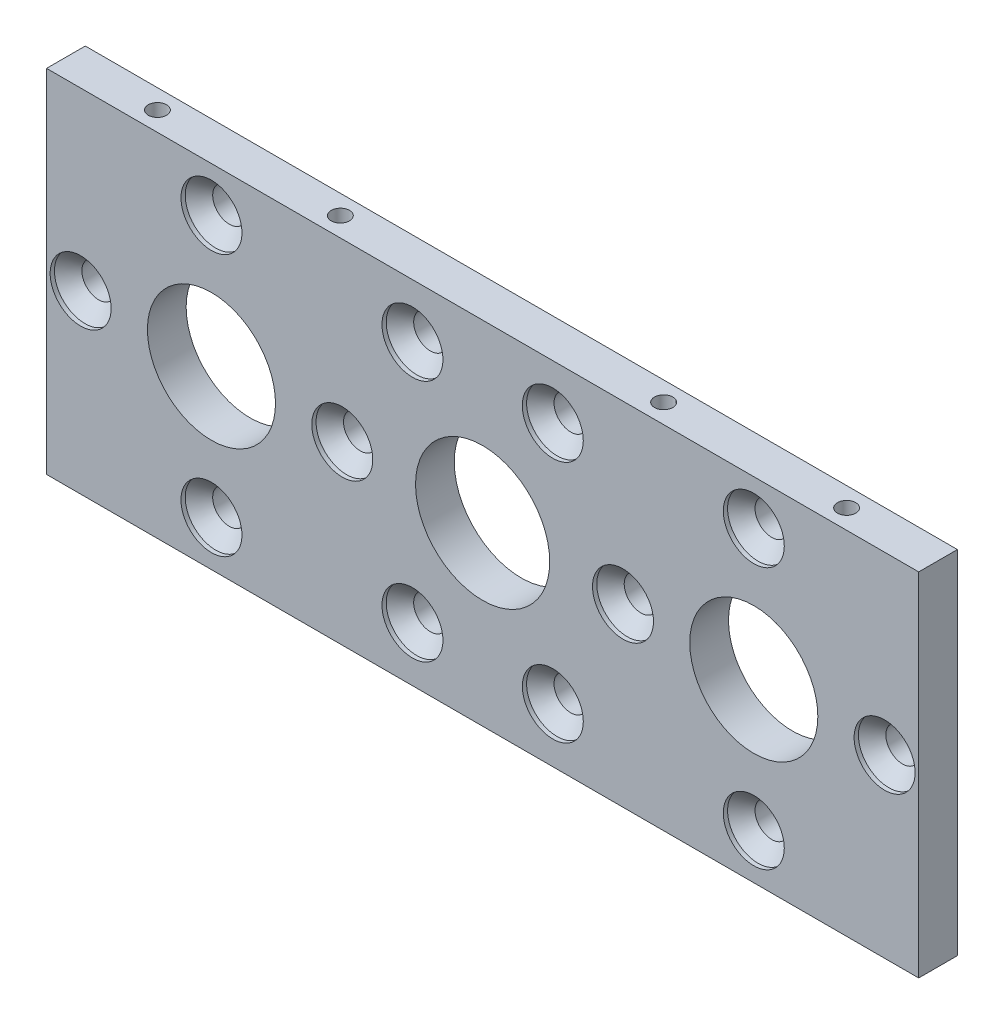
from build123d import *

# Parameters (mm, degrees)
ESBO_O1_W                        = 143.01
ESBO_O1_H                        = 54.05
RESSALTO_EXTRUS_O1_DEPTH         = 6.35
ESBO_O2_R                        = 2.75
CORTE_EXTRUS_O1_DEPTH            = 10
ESBO_O3_R                        = 10.5
ESBO_O3_R_2                      = 11
CORTE_EXTRUS_O2_DEPTH            = 10
ESBO_O4_W                        = 143.01
ESBO_O4_H                        = 3.62
RESSALTO_EXTRUS_O2_DEPTH         = 6.35
ESBO_O8_R                        = 1.5
CORTE_EXTRUS_O3_DEPTH            = 15
ESBO_O9_R                        = 5
CORTE_EXTRUS_O4_DEPTH            = 0.7
ESBO_O12_R                       = 5
CORTE_EXTRUS_O5_DEPTH            = 2.5
CORTE_EXTRUS_O5_DRAFT            = -45
CORTE_EXTRUS_O5_PROFILE_2_DEPTH  = 2.5
CORTE_EXTRUS_O5_PROFILE_2_DRAFT  = -45
CORTE_EXTRUS_O5_PROFILE_3_DEPTH  = 2.5
CORTE_EXTRUS_O5_PROFILE_3_DRAFT  = -45
CORTE_EXTRUS_O5_PROFILE_4_DEPTH  = 2.5
CORTE_EXTRUS_O5_PROFILE_4_DRAFT  = -45
CORTE_EXTRUS_O5_PROFILE_5_DEPTH  = 2.5
CORTE_EXTRUS_O5_PROFILE_5_DRAFT  = -45
CORTE_EXTRUS_O5_PROFILE_6_DEPTH  = 2.5
CORTE_EXTRUS_O5_PROFILE_6_DRAFT  = -45
CORTE_EXTRUS_O5_PROFILE_7_DEPTH  = 2.5
CORTE_EXTRUS_O5_PROFILE_7_DRAFT  = -45
CORTE_EXTRUS_O5_PROFILE_8_DEPTH  = 2.5
CORTE_EXTRUS_O5_PROFILE_8_DRAFT  = -45
CORTE_EXTRUS_O5_PROFILE_9_DEPTH  = 2.5
CORTE_EXTRUS_O5_PROFILE_9_DRAFT  = -45
CORTE_EXTRUS_O5_PROFILE_10_DEPTH = 2.5
CORTE_EXTRUS_O5_PROFILE_10_DRAFT = -45
CORTE_EXTRUS_O5_PROFILE_11_DEPTH = 2.5
CORTE_EXTRUS_O5_PROFILE_11_DRAFT = -45
CORTE_EXTRUS_O5_PROFILE_12_DEPTH = 2.5
CORTE_EXTRUS_O5_PROFILE_12_DRAFT = -45


with BuildPart() as part:
    # Esboço1 → Ressalto-extrusão1 (new body)
    with BuildSketch(Plane.XY):
        Rectangle(ESBO_O1_W, ESBO_O1_H)
    extrude(amount=RESSALTO_EXTRUS_O1_DEPTH)

    # Esboço2 → Corte-extrusão1 (cut)
    with BuildSketch(Plane(origin=(0, 0, 0), x_dir=(-1, 0, 0), z_dir=(0, 0, -1))):
        with Locations((-44.463136928, 23.291850449)):
            Circle(ESBO_O2_R)
        with Locations((-65.913136928, 1.841850449)):
            Circle(ESBO_O2_R)
        with Locations((-44.463136928, -19.608149551)):
            Circle(ESBO_O2_R)
        with Locations((-23.013136928, 1.841850449)):
            Circle(ESBO_O2_R)
        with Locations((-11.505636928, 21.773425117)):
            Circle(ESBO_O2_R)
        with Locations((11.509363072, 21.773425117)):
            Circle(ESBO_O2_R)
        with Locations((23.016863072, 1.841850449)):
            Circle(ESBO_O2_R)
        with Locations((11.509363072, -18.089724219)):
            Circle(ESBO_O2_R)
        with Locations((-11.505636928, -18.089724219)):
            Circle(ESBO_O2_R)
        with Locations((44.466863072, -19.608149551)):
            Circle(ESBO_O2_R)
        with Locations((65.916863072, 1.841850449)):
            Circle(ESBO_O2_R)
        with Locations((44.466863072, 23.291850449)):
            Circle(ESBO_O2_R)
    extrude(amount=-CORTE_EXTRUS_O1_DEPTH, mode=Mode.SUBTRACT)

    # Esboço3 → Corte-extrusão2 (cut)
    with BuildSketch(Plane(origin=(0, 0, 0), x_dir=(-1, 0, 0), z_dir=(0, 0, -1))):
        with Locations((-44.463136928, 1.841850449)):
            Circle(ESBO_O3_R)
        with Locations((0.001863072, 1.841850449)):
            Circle(ESBO_O3_R_2)
        with Locations((44.466863072, 1.841850449)):
            Circle(ESBO_O3_R)
    extrude(amount=-CORTE_EXTRUS_O2_DEPTH, mode=Mode.SUBTRACT)

    # Esboço4 → Ressalto-extrusão2 (add)
    with BuildSketch(Plane.XY):
        with Locations((0, 28.835)):
            Rectangle(ESBO_O4_W, ESBO_O4_H)
    extrude(amount=RESSALTO_EXTRUS_O2_DEPTH)

    # Esboço8 → Corte-extrusão3 (cut)
    with BuildSketch(Plane(origin=(0, 30.645, 0), x_dir=(1, 0, 0), z_dir=(0, 1, 0))):
        with Locations(Location((56.505, -3.175, 0), (0, 0, 270))):
            Circle(ESBO_O8_R)
        with Locations(Location((26.505, -3.175, 0), (0, 0, 270))):
            Circle(ESBO_O8_R)
        with Locations(Location((-26.505, -3.175, 0), (0, 0, 90))):
            Circle(ESBO_O8_R)
        with Locations(Location((-56.505, -3.175, 0), (0, 0, 90))):
            Circle(ESBO_O8_R)
    extrude(amount=-CORTE_EXTRUS_O3_DEPTH, mode=Mode.SUBTRACT)

    # Esboço9 → Corte-extrusão4 (cut)
    with BuildSketch(Plane.XY.offset(6.35)):
        with Locations((44.463136928, -19.608149551)):
            Circle(ESBO_O9_R)
        with Locations((65.913136928, 1.841850449)):
            Circle(ESBO_O9_R)
        with Locations((44.463136928, 23.291850449)):
            Circle(ESBO_O9_R)
        with Locations((23.013136928, 1.841850449)):
            Circle(ESBO_O9_R)
        with Locations((11.505636928, -18.089724219)):
            Circle(ESBO_O9_R)
        with Locations((11.505636928, 21.773425117)):
            Circle(ESBO_O9_R)
        with Locations((-11.509363072, 21.773425117)):
            Circle(ESBO_O9_R)
        with Locations((-23.016863072, 1.841850449)):
            Circle(ESBO_O9_R)
        with Locations((-11.509363072, -18.089724219)):
            Circle(ESBO_O9_R)
        with Locations((-44.466863072, 23.291850449)):
            Circle(ESBO_O9_R)
        with Locations((-65.916863072, 1.841850449)):
            Circle(ESBO_O9_R)
        with Locations((-44.466863072, -19.608149551)):
            Circle(ESBO_O9_R)
    extrude(amount=-CORTE_EXTRUS_O4_DEPTH, mode=Mode.SUBTRACT)


with BuildPart() as corte_extrus_o5_tool:
    # Esboço12 → Corte-extrusão5 (with draft: the straight prism first)
    with BuildSketch(Plane.XY.offset(5.65)):
        with Locations((-65.916863072, 1.841850449)):
            Circle(ESBO_O12_R)
    extrude(amount=-CORTE_EXTRUS_O5_DEPTH)
    # Corte-extrusão5: the draft: its side faces are tilted about the plane it starts from
    corte_extrus_o5_sides = [corte_extrus_o5_tool.faces().sort_by_distance(p)[0] for p in [
        (-70.916863072, 1.841850449, 4.4),
    ]]
    draft(corte_extrus_o5_sides, Plane.XY.offset(5.65), CORTE_EXTRUS_O5_DRAFT)


with BuildPart() as part_1:
    add(part.part)

    # Corte-extrusão5: cut by corte_extrus_o5_tool
    add(corte_extrus_o5_tool.part, mode=Mode.SUBTRACT)


with BuildPart() as corte_extrus_o5_profile_2_tool:
    # Esboço12 → Corte-extrusão5 profile 2 (with draft: the straight prism first)
    with BuildSketch(Plane.XY.offset(5.65)):
        with Locations((-44.466863072, 23.291850449)):
            Circle(ESBO_O12_R)
    extrude(amount=-CORTE_EXTRUS_O5_PROFILE_2_DEPTH)
    # Corte-extrusão5 profile 2: the draft: its side faces are tilted about the plane it starts from
    corte_extrus_o5_profile_2_sides = [corte_extrus_o5_profile_2_tool.faces().sort_by_distance(p)[0] for p in [
        (-49.466863072, 23.291850449, 4.4),
    ]]
    draft(corte_extrus_o5_profile_2_sides, Plane.XY.offset(5.65), CORTE_EXTRUS_O5_PROFILE_2_DRAFT)


with BuildPart() as part_2:
    add(part_1.part)

    # Corte-extrusão5 profile 2: cut by corte_extrus_o5_profile_2_tool
    add(corte_extrus_o5_profile_2_tool.part, mode=Mode.SUBTRACT)


with BuildPart() as corte_extrus_o5_profile_3_tool:
    # Esboço12 → Corte-extrusão5 profile 3 (with draft: the straight prism first)
    with BuildSketch(Plane.XY.offset(5.65)):
        with Locations((-23.016863072, 1.841850449)):
            Circle(ESBO_O12_R)
    extrude(amount=-CORTE_EXTRUS_O5_PROFILE_3_DEPTH)
    # Corte-extrusão5 profile 3: the draft: its side faces are tilted about the plane it starts from
    corte_extrus_o5_profile_3_sides = [corte_extrus_o5_profile_3_tool.faces().sort_by_distance(p)[0] for p in [
        (-28.016863072, 1.841850449, 4.4),
    ]]
    draft(corte_extrus_o5_profile_3_sides, Plane.XY.offset(5.65), CORTE_EXTRUS_O5_PROFILE_3_DRAFT)


with BuildPart() as part_3:
    add(part_2.part)

    # Corte-extrusão5 profile 3: cut by corte_extrus_o5_profile_3_tool
    add(corte_extrus_o5_profile_3_tool.part, mode=Mode.SUBTRACT)


with BuildPart() as corte_extrus_o5_profile_4_tool:
    # Esboço12 → Corte-extrusão5 profile 4 (with draft: the straight prism first)
    with BuildSketch(Plane.XY.offset(5.65)):
        with Locations((-11.509363072, 21.773425117)):
            Circle(ESBO_O12_R)
    extrude(amount=-CORTE_EXTRUS_O5_PROFILE_4_DEPTH)
    # Corte-extrusão5 profile 4: the draft: its side faces are tilted about the plane it starts from
    corte_extrus_o5_profile_4_sides = [corte_extrus_o5_profile_4_tool.faces().sort_by_distance(p)[0] for p in [
        (-16.509363072, 21.773425117, 4.4),
    ]]
    draft(corte_extrus_o5_profile_4_sides, Plane.XY.offset(5.65), CORTE_EXTRUS_O5_PROFILE_4_DRAFT)


with BuildPart() as part_4:
    add(part_3.part)

    # Corte-extrusão5 profile 4: cut by corte_extrus_o5_profile_4_tool
    add(corte_extrus_o5_profile_4_tool.part, mode=Mode.SUBTRACT)


with BuildPart() as corte_extrus_o5_profile_5_tool:
    # Esboço12 → Corte-extrusão5 profile 5 (with draft: the straight prism first)
    with BuildSketch(Plane.XY.offset(5.65)):
        with Locations((-44.466863072, -19.608149551)):
            Circle(ESBO_O12_R)
    extrude(amount=-CORTE_EXTRUS_O5_PROFILE_5_DEPTH)
    # Corte-extrusão5 profile 5: the draft: its side faces are tilted about the plane it starts from
    corte_extrus_o5_profile_5_sides = [corte_extrus_o5_profile_5_tool.faces().sort_by_distance(p)[0] for p in [
        (-49.466863072, -19.608149551, 4.4),
    ]]
    draft(corte_extrus_o5_profile_5_sides, Plane.XY.offset(5.65), CORTE_EXTRUS_O5_PROFILE_5_DRAFT)


with BuildPart() as part_5:
    add(part_4.part)

    # Corte-extrusão5 profile 5: cut by corte_extrus_o5_profile_5_tool
    add(corte_extrus_o5_profile_5_tool.part, mode=Mode.SUBTRACT)


with BuildPart() as corte_extrus_o5_profile_6_tool:
    # Esboço12 → Corte-extrusão5 profile 6 (with draft: the straight prism first)
    with BuildSketch(Plane.XY.offset(5.65)):
        with Locations((-11.509363072, -18.089724219)):
            Circle(ESBO_O12_R)
    extrude(amount=-CORTE_EXTRUS_O5_PROFILE_6_DEPTH)
    # Corte-extrusão5 profile 6: the draft: its side faces are tilted about the plane it starts from
    corte_extrus_o5_profile_6_sides = [corte_extrus_o5_profile_6_tool.faces().sort_by_distance(p)[0] for p in [
        (-16.509363072, -18.089724219, 4.4),
    ]]
    draft(corte_extrus_o5_profile_6_sides, Plane.XY.offset(5.65), CORTE_EXTRUS_O5_PROFILE_6_DRAFT)


with BuildPart() as part_6:
    add(part_5.part)

    # Corte-extrusão5 profile 6: cut by corte_extrus_o5_profile_6_tool
    add(corte_extrus_o5_profile_6_tool.part, mode=Mode.SUBTRACT)


with BuildPart() as corte_extrus_o5_profile_7_tool:
    # Esboço12 → Corte-extrusão5 profile 7 (with draft: the straight prism first)
    with BuildSketch(Plane.XY.offset(5.65)):
        with Locations((11.505636928, -18.089724219)):
            Circle(ESBO_O12_R)
    extrude(amount=-CORTE_EXTRUS_O5_PROFILE_7_DEPTH)
    # Corte-extrusão5 profile 7: the draft: its side faces are tilted about the plane it starts from
    corte_extrus_o5_profile_7_sides = [corte_extrus_o5_profile_7_tool.faces().sort_by_distance(p)[0] for p in [
        (6.505636928, -18.089724219, 4.4),
    ]]
    draft(corte_extrus_o5_profile_7_sides, Plane.XY.offset(5.65), CORTE_EXTRUS_O5_PROFILE_7_DRAFT)


with BuildPart() as part_7:
    add(part_6.part)

    # Corte-extrusão5 profile 7: cut by corte_extrus_o5_profile_7_tool
    add(corte_extrus_o5_profile_7_tool.part, mode=Mode.SUBTRACT)


with BuildPart() as corte_extrus_o5_profile_8_tool:
    # Esboço12 → Corte-extrusão5 profile 8 (with draft: the straight prism first)
    with BuildSketch(Plane.XY.offset(5.65)):
        with Locations((44.463136928, -19.608149551)):
            Circle(ESBO_O12_R)
    extrude(amount=-CORTE_EXTRUS_O5_PROFILE_8_DEPTH)
    # Corte-extrusão5 profile 8: the draft: its side faces are tilted about the plane it starts from
    corte_extrus_o5_profile_8_sides = [corte_extrus_o5_profile_8_tool.faces().sort_by_distance(p)[0] for p in [
        (39.463136928, -19.608149551, 4.4),
    ]]
    draft(corte_extrus_o5_profile_8_sides, Plane.XY.offset(5.65), CORTE_EXTRUS_O5_PROFILE_8_DRAFT)


with BuildPart() as part_8:
    add(part_7.part)

    # Corte-extrusão5 profile 8: cut by corte_extrus_o5_profile_8_tool
    add(corte_extrus_o5_profile_8_tool.part, mode=Mode.SUBTRACT)


with BuildPart() as corte_extrus_o5_profile_9_tool:
    # Esboço12 → Corte-extrusão5 profile 9 (with draft: the straight prism first)
    with BuildSketch(Plane.XY.offset(5.65)):
        with Locations((23.013136928, 1.841850449)):
            Circle(ESBO_O12_R)
    extrude(amount=-CORTE_EXTRUS_O5_PROFILE_9_DEPTH)
    # Corte-extrusão5 profile 9: the draft: its side faces are tilted about the plane it starts from
    corte_extrus_o5_profile_9_sides = [corte_extrus_o5_profile_9_tool.faces().sort_by_distance(p)[0] for p in [
        (18.013136928, 1.841850449, 4.4),
    ]]
    draft(corte_extrus_o5_profile_9_sides, Plane.XY.offset(5.65), CORTE_EXTRUS_O5_PROFILE_9_DRAFT)


with BuildPart() as part_9:
    add(part_8.part)

    # Corte-extrusão5 profile 9: cut by corte_extrus_o5_profile_9_tool
    add(corte_extrus_o5_profile_9_tool.part, mode=Mode.SUBTRACT)


with BuildPart() as corte_extrus_o5_profile_10_tool:
    # Esboço12 → Corte-extrusão5 profile 10 (with draft: the straight prism first)
    with BuildSketch(Plane.XY.offset(5.65)):
        with Locations((65.913136928, 1.841850449)):
            Circle(ESBO_O12_R)
    extrude(amount=-CORTE_EXTRUS_O5_PROFILE_10_DEPTH)
    # Corte-extrusão5 profile 10: the draft: its side faces are tilted about the plane it starts from
    corte_extrus_o5_profile_10_sides = [corte_extrus_o5_profile_10_tool.faces().sort_by_distance(p)[0] for p in [
        (60.913136928, 1.841850449, 4.4),
    ]]
    draft(corte_extrus_o5_profile_10_sides, Plane.XY.offset(5.65), CORTE_EXTRUS_O5_PROFILE_10_DRAFT)


with BuildPart() as part_10:
    add(part_9.part)

    # Corte-extrusão5 profile 10: cut by corte_extrus_o5_profile_10_tool
    add(corte_extrus_o5_profile_10_tool.part, mode=Mode.SUBTRACT)


with BuildPart() as corte_extrus_o5_profile_11_tool:
    # Esboço12 → Corte-extrusão5 profile 11 (with draft: the straight prism first)
    with BuildSketch(Plane.XY.offset(5.65)):
        with Locations((44.463136928, 23.291850449)):
            Circle(ESBO_O12_R)
    extrude(amount=-CORTE_EXTRUS_O5_PROFILE_11_DEPTH)
    # Corte-extrusão5 profile 11: the draft: its side faces are tilted about the plane it starts from
    corte_extrus_o5_profile_11_sides = [corte_extrus_o5_profile_11_tool.faces().sort_by_distance(p)[0] for p in [
        (39.463136928, 23.291850449, 4.4),
    ]]
    draft(corte_extrus_o5_profile_11_sides, Plane.XY.offset(5.65), CORTE_EXTRUS_O5_PROFILE_11_DRAFT)


with BuildPart() as part_11:
    add(part_10.part)

    # Corte-extrusão5 profile 11: cut by corte_extrus_o5_profile_11_tool
    add(corte_extrus_o5_profile_11_tool.part, mode=Mode.SUBTRACT)


with BuildPart() as corte_extrus_o5_profile_12_tool:
    # Esboço12 → Corte-extrusão5 profile 12 (with draft: the straight prism first)
    with BuildSketch(Plane.XY.offset(5.65)):
        with Locations((11.505636928, 21.773425117)):
            Circle(ESBO_O12_R)
    extrude(amount=-CORTE_EXTRUS_O5_PROFILE_12_DEPTH)
    # Corte-extrusão5 profile 12: the draft: its side faces are tilted about the plane it starts from
    corte_extrus_o5_profile_12_sides = [corte_extrus_o5_profile_12_tool.faces().sort_by_distance(p)[0] for p in [
        (6.505636928, 21.773425117, 4.4),
    ]]
    draft(corte_extrus_o5_profile_12_sides, Plane.XY.offset(5.65), CORTE_EXTRUS_O5_PROFILE_12_DRAFT)


with BuildPart() as part_12:
    add(part_11.part)

    # Corte-extrusão5 profile 12: cut by corte_extrus_o5_profile_12_tool
    add(corte_extrus_o5_profile_12_tool.part, mode=Mode.SUBTRACT)


solid = part_12.part
